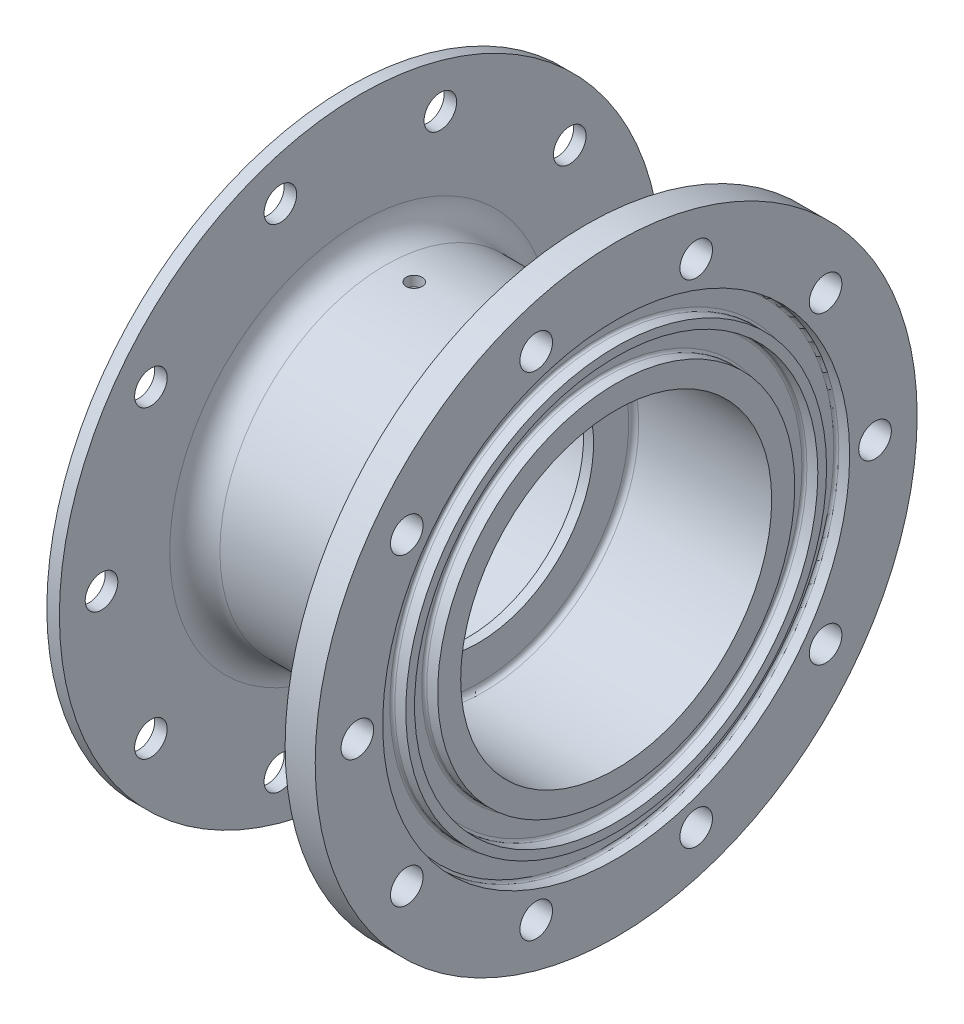
from build123d import *

# Parameters (mm, degrees)
SKETCH3_R                      = 3.25
CUT_EXTRUDE3_DEPTH             = 101.310767119
CIRPATTERN1_COUNT              = 10
F_3_2_3_2_DIAMETER_HOLE1_D     = 3.2
F_3_2_3_2_DIAMETER_HOLE1_DEPTH = 5
F_3_2_3_2_DIAMETER_HOLE1_TIP   = 0.96137699


with BuildPart() as part:
    # Sketch1 → Revolve9 (revolve)
    with BuildSketch(Plane.XY, mode=Mode.PRIVATE) as revolve9_sk:
        with BuildLine():
            Line((-1, -23), (-1, -30))
            ThreePointArc((-1, -30), (-1.292893219, -30.707106781), (-2, -31))
            Line((-2, -31), (-25, -31))
            Line((-25, -31), (-25, -60))
            Line((-25, -60), (-22.5, -60))
            Line((-22.5, -60), (-22.5, -38))
            ThreePointArc((-22.5, -38), (-21.035533906, -34.464466094), (-17.5, -33))
            Line((-17.5, -33), (17.5, -33))
            ThreePointArc((17.5, -33), (21.035533906, -34.464466094), (22.5, -38))
            Line((22.5, -38), (22.5, -60))
            Line((22.5, -60), (25, -60))
            Line((25, -60), (28.5, -60))
            Line((28.5, -60), (28.5, -31))
            Line((28.5, -31), (25, -31))
            Line((25, -31), (2, -31))
            ThreePointArc((2, -31), (1.292893219, -30.707106781), (1, -30))
            Line((1, -30), (1, -23))
            Line((1, -23), (-1, -23))
        make_face()
    revolve(revolve9_sk.sketch.rotate(Axis((-117.507853403, 0, 0), (1, 0, 0)), 270), axis=Axis((-117.507853403, 0, 0), (1, 0, 0)))

    # Sketch3 → Cut-Extrude3 (cut, through all)
    with BuildSketch(Plane.ZY.offset(25)):
        with Locations((-15.94527691, -49.074516241)):
            Circle(SKETCH3_R)
    cut_extrude3 = extrude(amount=-CUT_EXTRUDE3_DEPTH, mode=Mode.SUBTRACT)

    # CirPattern1: Cut-Extrude3 ×10 about axis
    cirpattern1_axis = Axis((0, 0, 0), (1, 0, 0))
    for i in range(1, CIRPATTERN1_COUNT):
        add(cut_extrude3.rotate(cirpattern1_axis, i * 360 / CIRPATTERN1_COUNT), mode=Mode.SUBTRACT)

    # Ø3.2 (3.2) Diameter Hole1
    with Locations(Plane(origin=(-11.75, 33, 0), x_dir=(0, 0, 1), z_dir=(0, 1, 0))):
        with Locations((0, 0)):
            Hole(F_3_2_3_2_DIAMETER_HOLE1_D / 2, depth=F_3_2_3_2_DIAMETER_HOLE1_DEPTH)
            with Locations((0, 0, -(F_3_2_3_2_DIAMETER_HOLE1_DEPTH + F_3_2_3_2_DIAMETER_HOLE1_TIP / 2))):  # 118° drill point
                Cone(0, F_3_2_3_2_DIAMETER_HOLE1_D / 2, F_3_2_3_2_DIAMETER_HOLE1_TIP, mode=Mode.SUBTRACT)

    # Sketch8 → Cut-Revolve1 (revolve, cut)
    with BuildSketch(Plane.XY, mode=Mode.PRIVATE) as cut_revolve1_sk:
        with BuildLine():
            Line((28.5, 40.195), (26.33, 40.195))
            ThreePointArc((26.33, 40.195), (25.976446609, 40.048553391), (25.83, 39.695))
            Line((25.83, 39.695), (25.83, 36.095))
            ThreePointArc((25.83, 36.095), (25.976446609, 35.741446609), (26.33, 35.595))
            Line((26.33, 35.595), (28.5, 35.595))
            Line((28.5, 35.595), (28.5, 40.195))
        make_face()
        with BuildLine():
            Line((28.5, 41.945), (26.33, 41.945))
            ThreePointArc((26.33, 41.945), (25.976446609, 42.091446609), (25.83, 42.445))
            Line((25.83, 42.445), (25.83, 46.045))
            ThreePointArc((25.83, 46.045), (25.976446609, 46.398553391), (26.33, 46.545))
            Line((26.33, 46.545), (28.5, 46.545))
            Line((28.5, 46.545), (28.5, 41.945))
        make_face()
    revolve(cut_revolve1_sk.sketch.rotate(Axis((28.5, 0, 0), (-1, 0, 0)), 90), axis=Axis((28.5, 0, 0), (-1, 0, 0)), mode=Mode.SUBTRACT)


solid = part.part
